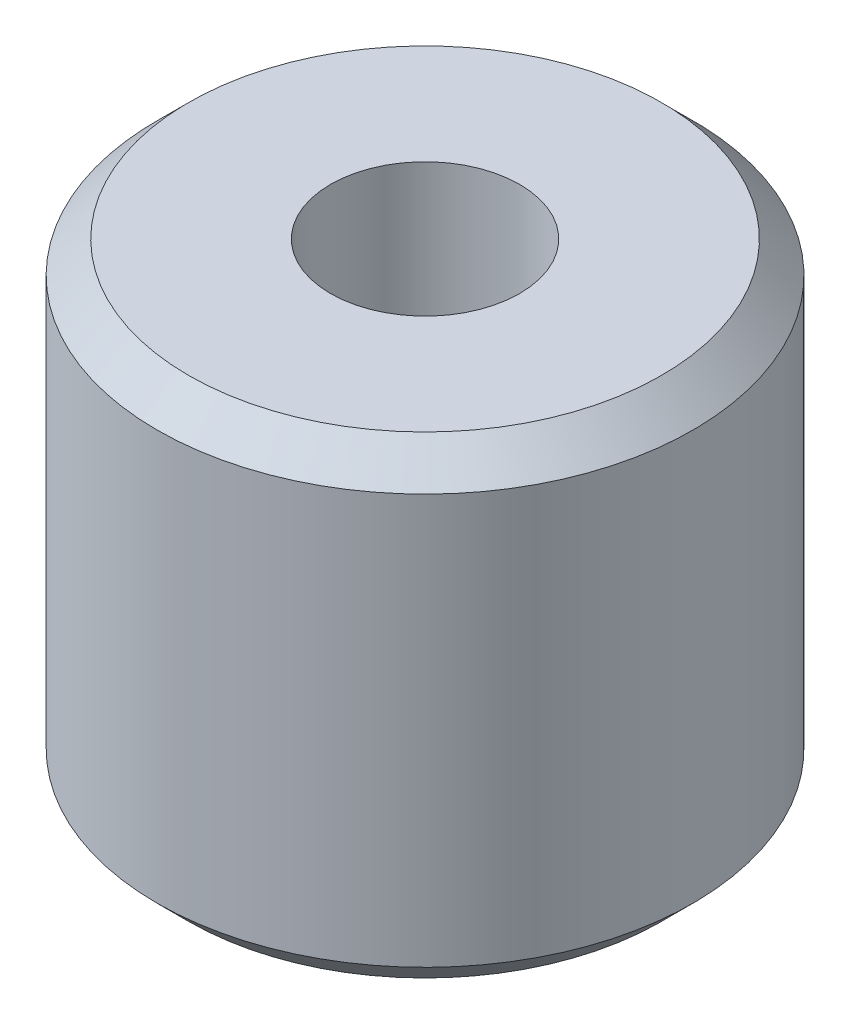
from build123d import *

# Parameters (mm, degrees)
SKETCH1_R           = 8.5
SKETCH1_R_2         = 3
BOSS_EXTRUDE1_DEPTH = 15
CHAMFER1_SIZE       = 1


with BuildPart() as part:
    # Sketch1 → Boss-Extrude1 (new body)
    with BuildSketch(Plane(origin=(0, 0, 0), x_dir=(1, 0, 0), z_dir=(0, 1, 0))):
        with Locations(Location((0, 0, 0), (0, 0, 270))):
            Circle(SKETCH1_R)
        with Locations(Location((0, 0, 0), (0, 0, 270))):
            Circle(SKETCH1_R_2, mode=Mode.SUBTRACT)
    extrude(amount=BOSS_EXTRUDE1_DEPTH)

    # Chamfer1
    chamfer1_edges = [part.edges().sort_by_distance(p)[0] for p in [
        (0, 0, -8.5),
        (0, 15, -8.5),
    ]]
    chamfer(chamfer1_edges, length=CHAMFER1_SIZE)


solid = part.part
